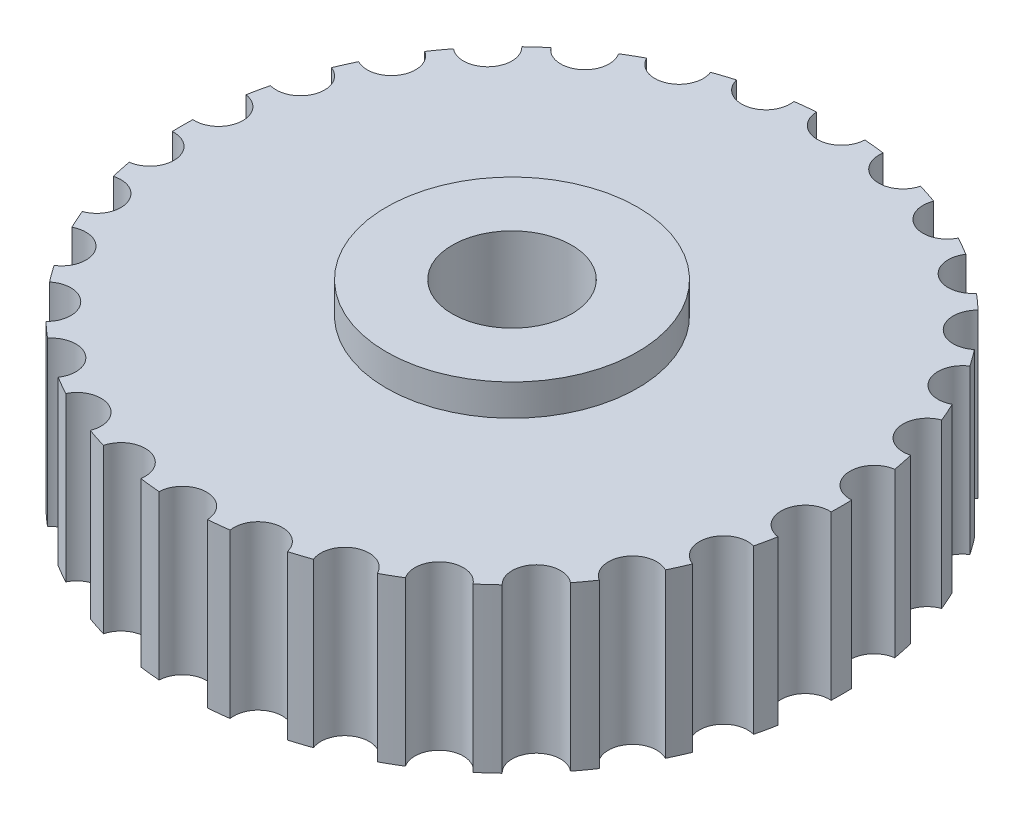
from build123d import *

# Parameters (mm, degrees)
SKETCH_1_R          = 10.5
EXTRUDE_1_DEPTH     = 5.2
SKETCH_2_R          = 1.9
CUT_EXTRUDE_1_DEPTH = 16.733403955
EXTRUDE_START       = 1
SKETCH_3_R          = 4
SKETCH_3_R_2        = 1.9
EXTRUDE_2_DEPTH     = 1
SKETCH_4_R          = 0.771394001
CUT_EXTRUDE_3_DEPTH = 16.733403955


with BuildPart() as part:
    # Эскиз1 → Бобышка-Вытянуть1 (new body)
    with BuildSketch(Plane(origin=(0, 0, 0), x_dir=(1, 0, 0), z_dir=(0, 1, 0))):
        with Locations(Location((0, 0, 0), (0, 0, 270))):
            Circle(SKETCH_1_R)
    extrude(amount=EXTRUDE_1_DEPTH)

    # Эскиз2 → Вырез-Вытянуть1 (cut, through all)
    with BuildSketch(Plane(origin=(0, 5.2, 0), x_dir=(1, 0, 0), z_dir=(0, 1, 0))):
        with Locations(Location((0, 0, 0), (0, 0, 270))):
            Circle(SKETCH_2_R)
    extrude(amount=-CUT_EXTRUDE_1_DEPTH, mode=Mode.SUBTRACT)

    # Эскиз3 → Бобышка-Вытянуть2 (add)
    with BuildSketch(Plane(origin=(0, 5.2, 0), x_dir=(1, 0, 0), z_dir=(0, 1, 0)).offset(EXTRUDE_START)):
        with Locations(Location((0, 0, 0), (0, 0, 270))):
            Circle(SKETCH_3_R)
        with Locations(Location((0, 0, 0), (0, 0, 270))):
            Circle(SKETCH_3_R_2, mode=Mode.SUBTRACT)
    extrude(amount=-EXTRUDE_2_DEPTH)

    # Эскиз4 → Вырез-Вытянуть3 (cut, through all)
    with BuildSketch(Plane(origin=(0, 5.2, 0), x_dir=(1, 0, 0), z_dir=(0, 1, 0))):
        with Locations((0, 10.5)):
            Circle(SKETCH_4_R)
        with Locations((2.183072754, 10.270549808)):
            Circle(SKETCH_4_R)
        with Locations((4.270734752, 9.592227305)):
            Circle(SKETCH_4_R)
        with Locations((6.171745149, 8.494678441)):
            Circle(SKETCH_4_R)
        with Locations((7.803020668, 7.025871367)):
            Circle(SKETCH_4_R)
        with Locations((9.09326674, 5.25)):
            Circle(SKETCH_4_R)
        with Locations((9.986093421, 3.244678441)):
            Circle(SKETCH_4_R)
        with Locations((10.442479901, 1.097548864)):
            Circle(SKETCH_4_R)
        with Locations((10.442479901, -1.097548864)):
            Circle(SKETCH_4_R)
        with Locations((9.986093421, -3.244678441)):
            Circle(SKETCH_4_R)
        with Locations((9.09326674, -5.25)):
            Circle(SKETCH_4_R)
        with Locations((7.803020668, -7.025871367)):
            Circle(SKETCH_4_R)
        with Locations((6.171745149, -8.494678441)):
            Circle(SKETCH_4_R)
        with Locations((4.270734752, -9.592227305)):
            Circle(SKETCH_4_R)
        with Locations((2.183072754, -10.270549808)):
            Circle(SKETCH_4_R)
        with Locations((0, -10.5)):
            Circle(SKETCH_4_R)
        with Locations((-2.183072754, -10.270549808)):
            Circle(SKETCH_4_R)
        with Locations((-4.270734752, -9.592227305)):
            Circle(SKETCH_4_R)
        with Locations((-6.171745149, -8.494678441)):
            Circle(SKETCH_4_R)
        with Locations((-7.803020668, -7.025871367)):
            Circle(SKETCH_4_R)
        with Locations((-9.09326674, -5.25)):
            Circle(SKETCH_4_R)
        with Locations((-9.986093421, -3.244678441)):
            Circle(SKETCH_4_R)
        with Locations((-10.442479901, -1.097548864)):
            Circle(SKETCH_4_R)
        with Locations((-10.442479901, 1.097548864)):
            Circle(SKETCH_4_R)
        with Locations((-9.986093421, 3.244678441)):
            Circle(SKETCH_4_R)
        with Locations((-9.09326674, 5.25)):
            Circle(SKETCH_4_R)
        with Locations((-7.803020668, 7.025871367)):
            Circle(SKETCH_4_R)
        with Locations((-6.171745149, 8.494678441)):
            Circle(SKETCH_4_R)
        with Locations((-4.270734752, 9.592227305)):
            Circle(SKETCH_4_R)
        with Locations((-2.183072754, 10.270549808)):
            Circle(SKETCH_4_R)
    extrude(amount=-CUT_EXTRUDE_3_DEPTH, mode=Mode.SUBTRACT)


solid = part.part
